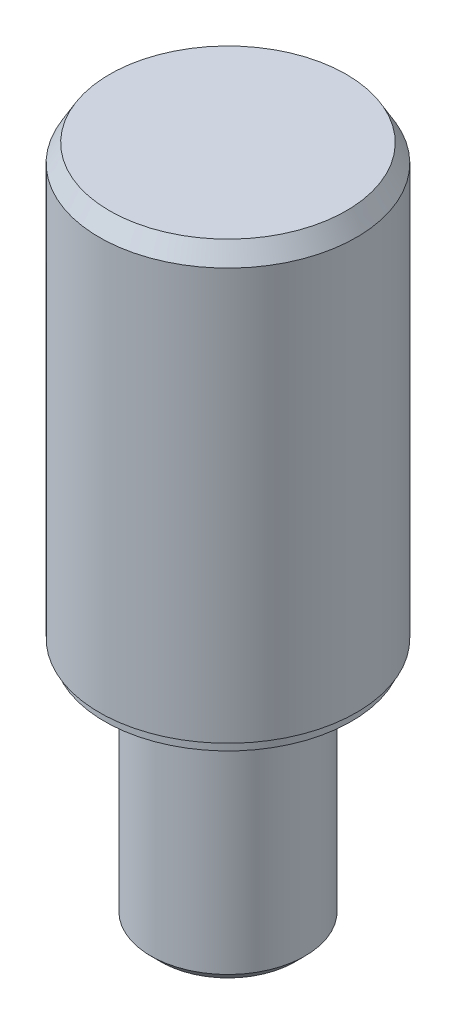
from build123d import *


with BuildPart() as part:
    # 草图1 → 旋转1 (revolve)
    with BuildSketch(Plane.XY, mode=Mode.PRIVATE) as revolve_1_sk:
        Polygon((0, 0), (0, 42), (11.5, 42), (12.5, 40.267949192), (12.5, 0.267949192), (12, 0.267949192), (12, -0.732050808), (7.5, -0.732050808), (7.5, -22.732050808), (6.5, -23.732050808), (0, -23.732050808), align=None)
    revolve(revolve_1_sk.sketch.rotate(Axis((0, 0, 0), (0, 1, 0)), 90), axis=Axis((0, 0, 0), (0, 1, 0)))


solid = part.part
